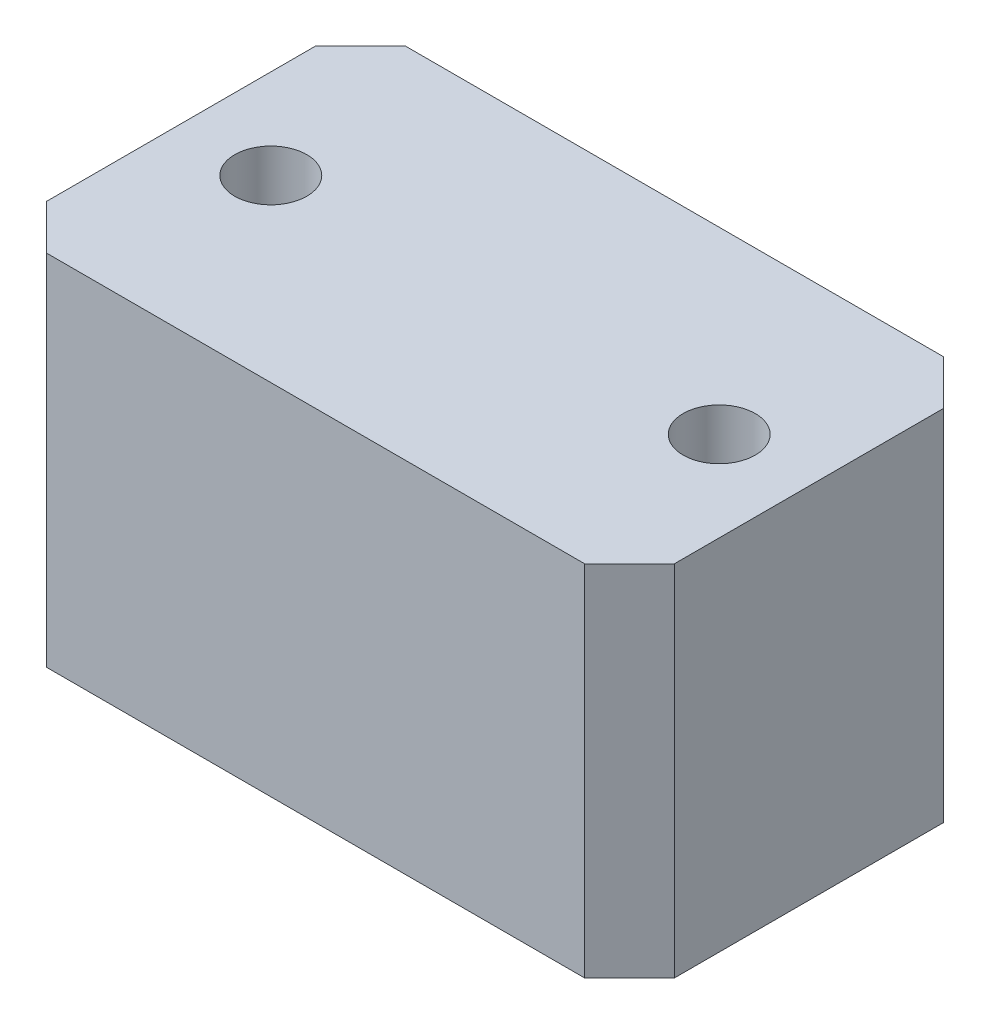
from build123d import *

# Parameters (mm, degrees)
SKETCH1_W              = 44.45
SKETCH1_H              = 25.4
BOSS_EXTRUDE1_DEPTH    = 25.4
F_10_CLEARANCE_HOLE1_D = 5.1054
CHAMFER1_SIZE          = 3.175


with BuildPart() as part:
    # Sketch1 → Boss-Extrude1 (new body)
    with BuildSketch(Plane(origin=(0, 0, 0), x_dir=(1, 0, 0), z_dir=(0, 1, 0))):
        Rectangle(SKETCH1_W, SKETCH1_H)
    extrude(amount=BOSS_EXTRUDE1_DEPTH)

    # #10 Clearance Hole1 (through all)
    with Locations(Plane(origin=(0, 25.4, 0), x_dir=(1, 0, 0), z_dir=(0, 1, 0))):
        with Locations((-15.875, 0), (15.875, 0)):
            Hole(F_10_CLEARANCE_HOLE1_D / 2)

    # Chamfer1
    chamfer1_edges = [part.edges().sort_by_distance(p)[0] for p in [
        (22.225, 12.7, 12.7),
        (-22.225, 12.7, 12.7),
        (-22.225, 12.7, -12.7),
        (22.225, 12.7, -12.7),
    ]]
    chamfer(chamfer1_edges, length=CHAMFER1_SIZE)


solid = part.part
